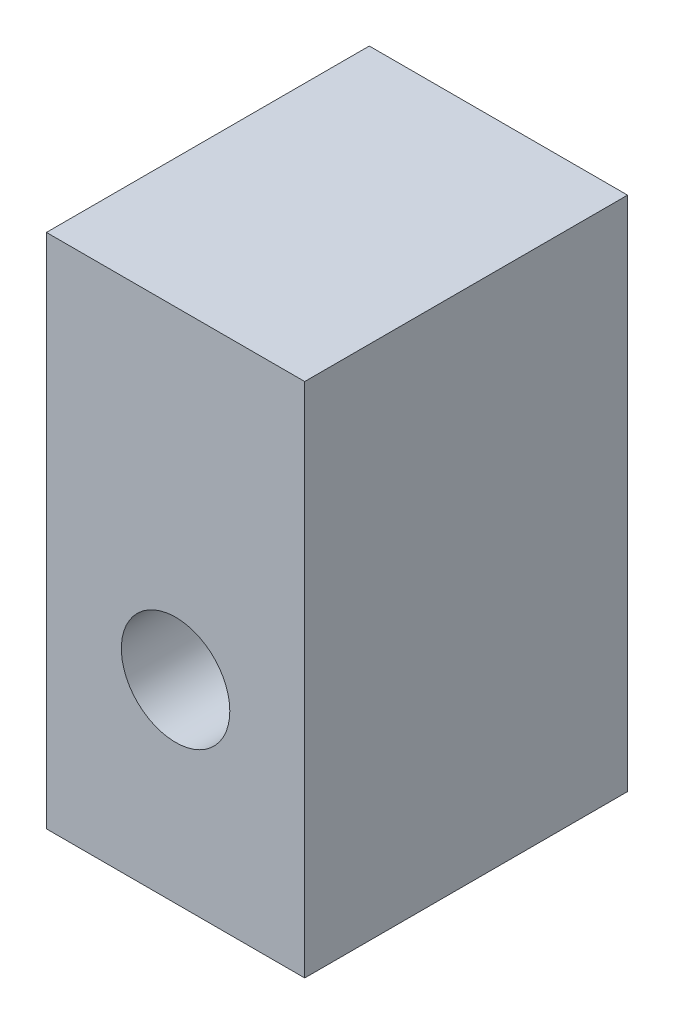
from build123d import *

# Parameters (mm, degrees)
SKETCH1_W               = 50.8
SKETCH1_H               = 63.5
BOSS_EXTRUDE2_DEPTH     = 101.6
CUT_EXTRUDE2_DEPTH      = 110.433918417
CUT_EXTRUDE2_DEPTH_BACK = 110.433918417
SKETCH4_R               = 10.668


with BuildPart() as part:
    # Sketch1 → Boss-Extrude2 (new body)
    with BuildSketch(Plane(origin=(0, 0, 0), x_dir=(1, 0, 0), z_dir=(0, 1, 0))):
        Rectangle(SKETCH1_W, SKETCH1_H)
    extrude(amount=BOSS_EXTRUDE2_DEPTH)

    # Sketch4 → Cut-Extrude2 (cut, two sides: drawn at the far end of the back side and taken through both)
    with BuildSketch(Plane.XY.offset(-CUT_EXTRUDE2_DEPTH_BACK)):
        with Locations((0, 38.1)):
            Circle(SKETCH4_R)
    extrude(amount=CUT_EXTRUDE2_DEPTH + CUT_EXTRUDE2_DEPTH_BACK, mode=Mode.SUBTRACT)


solid = part.part
